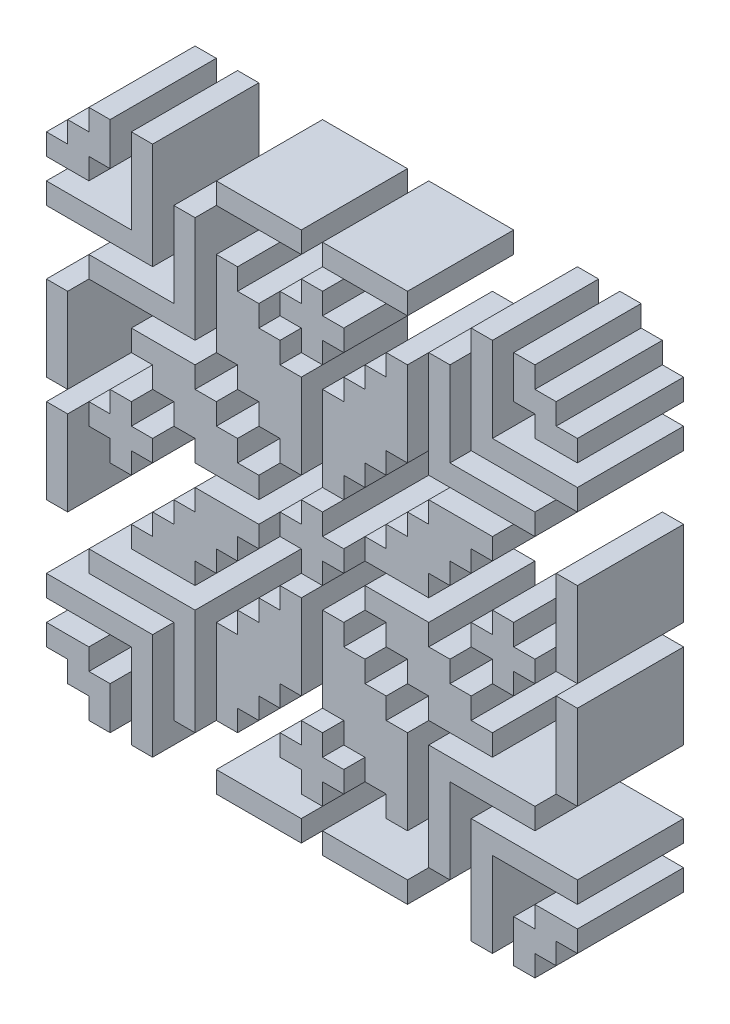
from build123d import *

# Parameters (mm, degrees)
EXTRUDE_3_DEPTH    = 5
EXTRUDE_3_2_DEPTH  = 5
EXTRUDE_3_3_DEPTH  = 5
EXTRUDE_3_4_DEPTH  = 5
EXTRUDE_3_5_DEPTH  = 5
EXTRUDE_3_6_DEPTH  = 5
EXTRUDE_3_7_DEPTH  = 5
EXTRUDE_3_8_DEPTH  = 5
SKETCH_3_W         = 4
SKETCH_3_H         = 1
EXTRUDE_3_9_DEPTH  = 5
EXTRUDE_3_10_DEPTH = 5
EXTRUDE_3_11_DEPTH = 5
EXTRUDE_3_12_DEPTH = 5
EXTRUDE_3_13_DEPTH = 5
EXTRUDE_3_14_DEPTH = 5
EXTRUDE_3_15_DEPTH = 5
EXTRUDE_3_16_DEPTH = 5
EXTRUDE_3_17_DEPTH = 5
SKETCH_3_W_2       = 1
SKETCH_3_H_2       = 4
EXTRUDE_3_18_DEPTH = 5
EXTRUDE_3_19_DEPTH = 5
EXTRUDE_3_20_DEPTH = 5
EXTRUDE_3_21_DEPTH = 5
EXTRUDE_3_22_DEPTH = 5
EXTRUDE_3_23_DEPTH = 5
EXTRUDE_3_24_DEPTH = 5
EXTRUDE_3_25_DEPTH = 5
EXTRUDE_3_26_DEPTH = 5
EXTRUDE_3_27_DEPTH = 5
EXTRUDE_3_28_DEPTH = 5
EXTRUDE_3_29_DEPTH = 5
EXTRUDE_3_30_DEPTH = 5
EXTRUDE_3_31_DEPTH = 5
EXTRUDE_3_32_DEPTH = 5
EXTRUDE_3_33_DEPTH = 5


with BuildPart() as part:
    # Эскиз3 → Бобышка-Вытянуть3 (new body)
    with BuildSketch(Plane.XY):
        Polygon((-0.5, -0.5), (-1.5, -0.5), (-1.5, 0.5), (-0.5, 0.5), (-0.5, 1.5), (0.5, 1.5), (0.5, 0.5), (1.5, 0.5), (1.5, -0.5), (0.5, -0.5), (0.5, -1.5), (-0.5, -1.5), align=None)
    extrude(amount=EXTRUDE_3_DEPTH)


with BuildPart() as body_2:
    # Эскиз3 → Extrude 3 2 (new body)
    with BuildSketch(Plane.XY):
        Polygon((-0.5, -9.5), (-1.5, -9.5), (-1.5, -8.5), (-0.5, -8.5), (-0.5, -7.5), (0.5, -7.5), (0.5, -8.5), (1.5, -8.5), (1.5, -9.5), (0.5, -9.5), (0.5, -10.5), (-0.5, -10.5), align=None)
    extrude(amount=EXTRUDE_3_2_DEPTH)


with BuildPart() as body_3:
    # Эскиз3 → Extrude 3 3 (new body)
    with BuildSketch(Plane.XY):
        Polygon((-0.5, 8.5), (-0.5, 7.5), (0.5, 7.5), (0.5, 8.5), (1.5, 8.5), (1.5, 9.5), (0.5, 9.5), (0.5, 10.5), (-0.5, 10.5), (-0.5, 9.5), (-1.5, 9.5), (-1.5, 8.5), align=None)
    extrude(amount=EXTRUDE_3_3_DEPTH)


with BuildPart() as body_4:
    # Эскиз3 → Extrude 3 4 (new body)
    with BuildSketch(Plane.XY):
        Polygon((2.5, -0.5), (5.5, -0.5), (5.5, -1.5), (6.5, -1.5), (6.5, -2.5), (7.5, -2.5), (7.5, -3.5), (8.5, -3.5), (8.5, -4.5), (5.5, -4.5), (5.5, -3.5), (4.5, -3.5), (4.5, -2.5), (3.5, -2.5), (3.5, -1.5), (2.5, -1.5), align=None)
    extrude(amount=EXTRUDE_3_4_DEPTH)


with BuildPart() as body_5:
    # Эскиз3 → Extrude 3 5 (new body)
    with BuildSketch(Plane.XY):
        Polygon((5.5, -10.5), (5.5, -5.5), (10.5, -5.5), (10.5, -6.5), (6.5, -6.5), (6.5, -10.5), align=None)
    extrude(amount=EXTRUDE_3_5_DEPTH)


with BuildPart() as body_6:
    # Эскиз3 → Extrude 3 6 (new body)
    with BuildSketch(Plane.XY):
        Polygon((8.5, -12.5), (7.5, -12.5), (7.5, -7.5), (12.5, -7.5), (12.5, -8.5), (8.5, -8.5), align=None)
    extrude(amount=EXTRUDE_3_6_DEPTH)


with BuildPart() as body_7:
    # Эскиз3 → Extrude 3 7 (new body)
    with BuildSketch(Plane.XY):
        Polygon((9.5, -12.5), (9.5, -10.5), (10.5, -10.5), (10.5, -9.5), (12.5, -9.5), (12.5, -10.5), (11.5, -10.5), (11.5, -11.5), (10.5, -11.5), (10.5, -12.5), align=None)
    extrude(amount=EXTRUDE_3_7_DEPTH)


with BuildPart() as body_8:
    # Эскиз3 → Extrude 3 8 (new body)
    with BuildSketch(Plane.XY):
        Polygon((0.5, -2.5), (0.5, -6.5), (1.5, -6.5), (1.5, -7.5), (2.5, -7.5), (2.5, -8.5), (3.5, -8.5), (3.5, -9.5), (4.5, -9.5), (4.5, -5.5), (3.5, -5.5), (3.5, -4.5), (2.5, -4.5), (2.5, -3.5), (1.5, -3.5), (1.5, -2.5), align=None)
    extrude(amount=EXTRUDE_3_8_DEPTH)


with BuildPart() as body_9:
    # Эскиз3 → Extrude 3 9 (new body)
    with BuildSketch(Plane.XY):
        with Locations((2.5, -12)):
            Rectangle(SKETCH_3_W, SKETCH_3_H)
    extrude(amount=EXTRUDE_3_9_DEPTH)


with BuildPart() as body_10:
    # Эскиз3 → Extrude 3 10 (new body)
    with BuildSketch(Plane.XY):
        Polygon((8.5, -0.5), (7.5, -0.5), (7.5, 0.5), (8.5, 0.5), (8.5, 1.5), (9.5, 1.5), (9.5, 0.5), (10.5, 0.5), (10.5, -0.5), (9.5, -0.5), (9.5, -1.5), (8.5, -1.5), align=None)
    extrude(amount=EXTRUDE_3_10_DEPTH)


with BuildPart() as body_11:
    # Эскиз3 → Extrude 3 11 (new body)
    with BuildSketch(Plane.XY):
        Polygon((-9.5, -0.5), (-10.5, -0.5), (-10.5, 0.5), (-9.5, 0.5), (-9.5, 1.5), (-8.5, 1.5), (-8.5, 0.5), (-7.5, 0.5), (-7.5, -0.5), (-8.5, -0.5), (-8.5, -1.5), (-9.5, -1.5), align=None)
    extrude(amount=EXTRUDE_3_11_DEPTH)


with BuildPart() as body_12:
    # Эскиз3 → Extrude 3 12 (new body)
    with BuildSketch(Plane.XY):
        with Locations((-2.5, -12)):
            Rectangle(SKETCH_3_W, SKETCH_3_H)
    extrude(amount=EXTRUDE_3_12_DEPTH)


with BuildPart() as body_13:
    # Эскиз3 → Extrude 3 13 (new body)
    with BuildSketch(Plane.XY):
        Polygon((-10.5, -12.5), (-9.5, -12.5), (-9.5, -10.5), (-10.5, -10.5), (-10.5, -9.5), (-12.5, -9.5), (-12.5, -10.5), (-11.5, -10.5), (-11.5, -11.5), (-10.5, -11.5), align=None)
    extrude(amount=EXTRUDE_3_13_DEPTH)


with BuildPart() as body_14:
    # Эскиз3 → Extrude 3 14 (new body)
    with BuildSketch(Plane.XY):
        Polygon((-12.5, -8.5), (-8.5, -8.5), (-8.5, -12.5), (-7.5, -12.5), (-7.5, -7.5), (-12.5, -7.5), align=None)
    extrude(amount=EXTRUDE_3_14_DEPTH)


with BuildPart() as body_15:
    # Эскиз3 → Extrude 3 15 (new body)
    with BuildSketch(Plane.XY):
        Polygon((-6.5, -6.5), (-6.5, -10.5), (-5.5, -10.5), (-5.5, -5.5), (-10.5, -5.5), (-10.5, -6.5), align=None)
    extrude(amount=EXTRUDE_3_15_DEPTH)


with BuildPart() as body_16:
    # Эскиз3 → Extrude 3 16 (new body)
    with BuildSketch(Plane.XY):
        Polygon((-3.5, -1.5), (-2.5, -1.5), (-2.5, -0.5), (-5.5, -0.5), (-5.5, -1.5), (-6.5, -1.5), (-6.5, -2.5), (-7.5, -2.5), (-7.5, -3.5), (-8.5, -3.5), (-8.5, -4.5), (-5.5, -4.5), (-5.5, -3.5), (-4.5, -3.5), (-4.5, -2.5), (-3.5, -2.5), align=None)
    extrude(amount=EXTRUDE_3_16_DEPTH)


with BuildPart() as body_17:
    # Эскиз3 → Extrude 3 17 (new body)
    with BuildSketch(Plane.XY):
        Polygon((-3.5, -9.5), (-4.5, -9.5), (-4.5, -5.5), (-3.5, -5.5), (-3.5, -4.5), (-2.5, -4.5), (-2.5, -3.5), (-1.5, -3.5), (-1.5, -2.5), (-0.5, -2.5), (-0.5, -6.5), (-1.5, -6.5), (-1.5, -7.5), (-2.5, -7.5), (-2.5, -8.5), (-3.5, -8.5), align=None)
    extrude(amount=EXTRUDE_3_17_DEPTH)


with BuildPart() as body_18:
    # Эскиз3 → Extrude 3 18 (new body)
    with BuildSketch(Plane.XY):
        with Locations((12, -2.5)):
            Rectangle(SKETCH_3_W_2, SKETCH_3_H_2)
    extrude(amount=EXTRUDE_3_18_DEPTH)


with BuildPart() as body_19:
    # Эскиз3 → Extrude 3 19 (new body)
    with BuildSketch(Plane.XY):
        with Locations((-12, -2.5)):
            Rectangle(SKETCH_3_W_2, SKETCH_3_H_2)
    extrude(amount=EXTRUDE_3_19_DEPTH)


with BuildPart() as body_20:
    # Эскиз3 → Extrude 3 20 (new body)
    with BuildSketch(Plane.XY):
        Polygon((-10.5, 11.5), (-10.5, 12.5), (-9.5, 12.5), (-9.5, 10.5), (-10.5, 10.5), (-10.5, 9.5), (-12.5, 9.5), (-12.5, 10.5), (-11.5, 10.5), (-11.5, 11.5), align=None)
    extrude(amount=EXTRUDE_3_20_DEPTH)


with BuildPart() as body_21:
    # Эскиз3 → Extrude 3 21 (new body)
    with BuildSketch(Plane.XY):
        Polygon((-12.5, 7.5), (-12.5, 8.5), (-8.5, 8.5), (-8.5, 12.5), (-7.5, 12.5), (-7.5, 7.5), align=None)
    extrude(amount=EXTRUDE_3_21_DEPTH)


with BuildPart() as body_22:
    # Эскиз3 → Extrude 3 22 (new body)
    with BuildSketch(Plane.XY):
        Polygon((-10.5, 6.5), (-6.5, 6.5), (-6.5, 10.5), (-5.5, 10.5), (-5.5, 5.5), (-10.5, 5.5), align=None)
    extrude(amount=EXTRUDE_3_22_DEPTH)


with BuildPart() as body_23:
    # Эскиз3 → Extrude 3 23 (new body)
    with BuildSketch(Plane.XY):
        with Locations((-12, 2.5)):
            Rectangle(SKETCH_3_W_2, SKETCH_3_H_2)
    extrude(amount=EXTRUDE_3_23_DEPTH)


with BuildPart() as body_24:
    # Эскиз3 → Extrude 3 24 (new body)
    with BuildSketch(Plane.XY):
        Polygon((-3.5, 2.5), (-3.5, 1.5), (-2.5, 1.5), (-2.5, 0.5), (-5.5, 0.5), (-5.5, 1.5), (-6.5, 1.5), (-6.5, 2.5), (-7.5, 2.5), (-7.5, 3.5), (-8.5, 3.5), (-8.5, 4.5), (-5.5, 4.5), (-5.5, 3.5), (-4.5, 3.5), (-4.5, 2.5), align=None)
    extrude(amount=EXTRUDE_3_24_DEPTH)


with BuildPart() as body_25:
    # Эскиз3 → Extrude 3 25 (new body)
    with BuildSketch(Plane.XY):
        Polygon((-3.5, 8.5), (-3.5, 9.5), (-4.5, 9.5), (-4.5, 5.5), (-3.5, 5.5), (-3.5, 4.5), (-2.5, 4.5), (-2.5, 3.5), (-1.5, 3.5), (-1.5, 2.5), (-0.5, 2.5), (-0.5, 6.5), (-1.5, 6.5), (-1.5, 7.5), (-2.5, 7.5), (-2.5, 8.5), align=None)
    extrude(amount=EXTRUDE_3_25_DEPTH)


with BuildPart() as body_26:
    # Эскиз3 → Extrude 3 26 (new body)
    with BuildSketch(Plane.XY):
        with Locations((-2.5, 12)):
            Rectangle(SKETCH_3_W, SKETCH_3_H)
    extrude(amount=EXTRUDE_3_26_DEPTH)


with BuildPart() as body_27:
    # Эскиз3 → Extrude 3 27 (new body)
    with BuildSketch(Plane.XY):
        with Locations((2.5, 12)):
            Rectangle(SKETCH_3_W, SKETCH_3_H)
    extrude(amount=EXTRUDE_3_27_DEPTH)


with BuildPart() as body_28:
    # Эскиз3 → Extrude 3 28 (new body)
    with BuildSketch(Plane.XY):
        Polygon((3.5, 9.5), (4.5, 9.5), (4.5, 5.5), (3.5, 5.5), (3.5, 4.5), (2.5, 4.5), (2.5, 3.5), (1.5, 3.5), (1.5, 2.5), (0.5, 2.5), (0.5, 6.5), (1.5, 6.5), (1.5, 7.5), (2.5, 7.5), (2.5, 8.5), (3.5, 8.5), align=None)
    extrude(amount=EXTRUDE_3_28_DEPTH)


with BuildPart() as body_29:
    # Эскиз3 → Extrude 3 29 (new body)
    with BuildSketch(Plane.XY):
        Polygon((10.5, 12.5), (9.5, 12.5), (9.5, 10.5), (10.5, 10.5), (10.5, 9.5), (12.5, 9.5), (12.5, 10.5), (11.5, 10.5), (11.5, 11.5), (10.5, 11.5), align=None)
    extrude(amount=EXTRUDE_3_29_DEPTH)


with BuildPart() as body_30:
    # Эскиз3 → Extrude 3 30 (new body)
    with BuildSketch(Plane.XY):
        Polygon((12.5, 8.5), (8.5, 8.5), (8.5, 12.5), (7.5, 12.5), (7.5, 7.5), (12.5, 7.5), align=None)
    extrude(amount=EXTRUDE_3_30_DEPTH)


with BuildPart() as body_31:
    # Эскиз3 → Extrude 3 31 (new body)
    with BuildSketch(Plane.XY):
        Polygon((6.5, 6.5), (6.5, 10.5), (5.5, 10.5), (5.5, 5.5), (10.5, 5.5), (10.5, 6.5), align=None)
    extrude(amount=EXTRUDE_3_31_DEPTH)


with BuildPart() as body_32:
    # Эскиз3 → Extrude 3 32 (new body)
    with BuildSketch(Plane.XY):
        Polygon((3.5, 1.5), (2.5, 1.5), (2.5, 0.5), (5.5, 0.5), (5.5, 1.5), (6.5, 1.5), (6.5, 2.5), (7.5, 2.5), (7.5, 3.5), (8.5, 3.5), (8.5, 4.5), (5.5, 4.5), (5.5, 3.5), (4.5, 3.5), (4.5, 2.5), (3.5, 2.5), align=None)
    extrude(amount=EXTRUDE_3_32_DEPTH)


with BuildPart() as body_33:
    # Эскиз3 → Extrude 3 33 (new body)
    with BuildSketch(Plane.XY):
        with Locations((12, 2.5)):
            Rectangle(SKETCH_3_W_2, SKETCH_3_H_2)
    extrude(amount=EXTRUDE_3_33_DEPTH)


solid = Compound([part.part, body_2.part, body_3.part, body_4.part, body_5.part, body_6.part, body_7.part, body_8.part, body_9.part, body_10.part, body_11.part, body_12.part, body_13.part, body_14.part, body_15.part, body_16.part, body_17.part, body_18.part, body_19.part, body_20.part, body_21.part, body_22.part, body_23.part, body_24.part, body_25.part, body_26.part, body_27.part, body_28.part, body_29.part, body_30.part, body_31.part, body_32.part, body_33.part])
